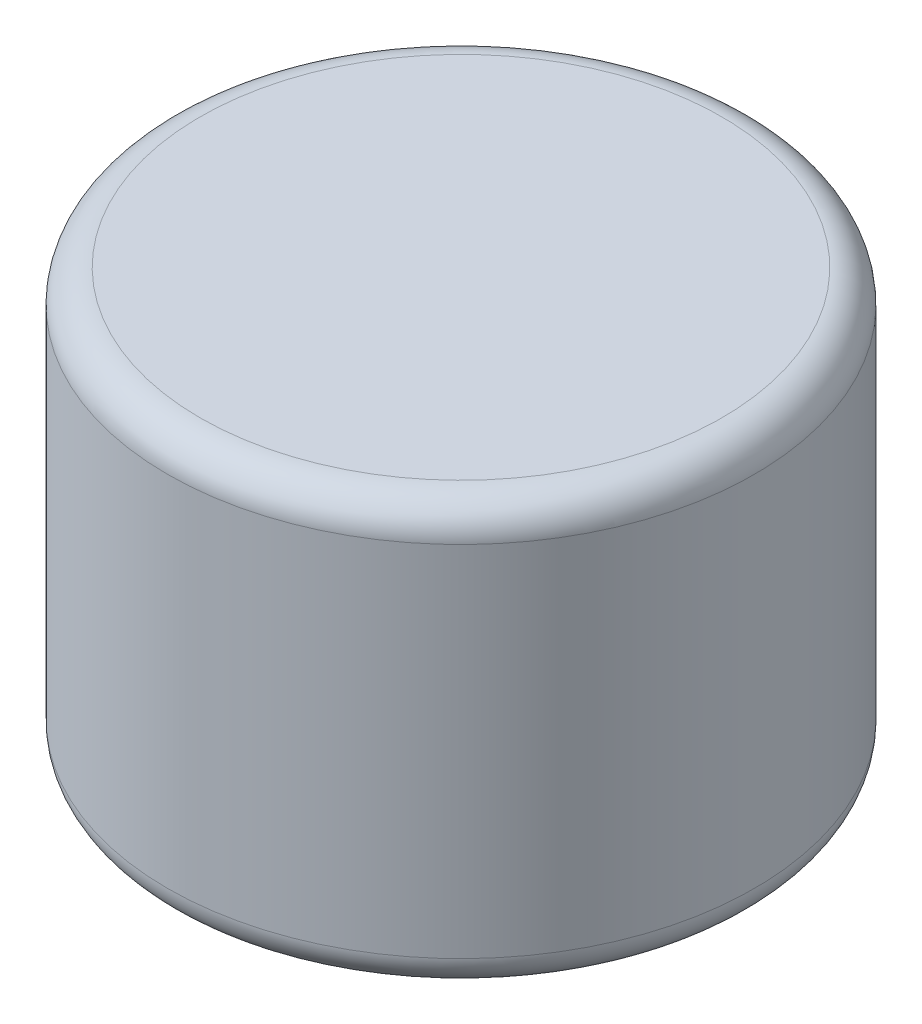
from build123d import *

# Parameters (mm, degrees)
SKETCH1_R           = 3.5
BOSS_EXTRUDE1_DEPTH = 7
SKETCH2_R           = 9
BOSS_EXTRUDE2_DEPTH = 4
BOSS_EXTRUDE3_START = 9
SKETCH3_R           = 9
SKETCH3_R_2         = 7
BOSS_EXTRUDE3_DEPTH = 9
FILLET1_R           = 1


with BuildPart() as part:
    # Sketch1 → Boss-Extrude1 (new body)
    with BuildSketch(Plane(origin=(0, 0, 0), x_dir=(1, 0, 0), z_dir=(0, 1, 0))):
        with Locations(Location((0, 0, 0), (0, 0, 270))):
            Circle(SKETCH1_R)
        with BuildLine():
            Line((3.023656727, 0.4), (-3.023656727, 0.4))
            ThreePointArc((-3.023656727, 0.4), (0, 3.05), (3.023656727, 0.4))
        make_face(mode=Mode.SUBTRACT)
        with BuildLine():
            Line((-3.023656727, -0.4), (3.023656727, -0.4))
            ThreePointArc((3.023656727, -0.4), (0, -3.05), (-3.023656727, -0.4))
        make_face(mode=Mode.SUBTRACT)
    extrude(amount=BOSS_EXTRUDE1_DEPTH)

    # Sketch2 → Boss-Extrude2 (add)
    with BuildSketch(Plane(origin=(0, 7, 0), x_dir=(1, 0, 0), z_dir=(0, 1, 0))):
        with Locations(Location((0, 0, 0), (0, 0, 270))):
            Circle(SKETCH2_R)
    extrude(amount=BOSS_EXTRUDE2_DEPTH)

    # Sketch3 → Boss-Extrude3 (add)
    with BuildSketch(Plane.XZ.offset(-7).offset(BOSS_EXTRUDE3_START)):
        with Locations(Location((0, 0, 0), (0, 0, 270))):
            Circle(SKETCH3_R)
        with Locations(Location((0, 0, 0), (0, 0, 270))):
            Circle(SKETCH3_R_2, mode=Mode.SUBTRACT)
    extrude(amount=-BOSS_EXTRUDE3_DEPTH)

    # Fillet1
    fillet1_edges = [part.edges().sort_by_distance(p)[0] for p in [
        (0, 11, -9),
        (0, 7, -3.5),
        (0, -2, 9),
        (0, 7, 7),
    ]]
    fillet(fillet1_edges, radius=FILLET1_R)


solid = part.part
